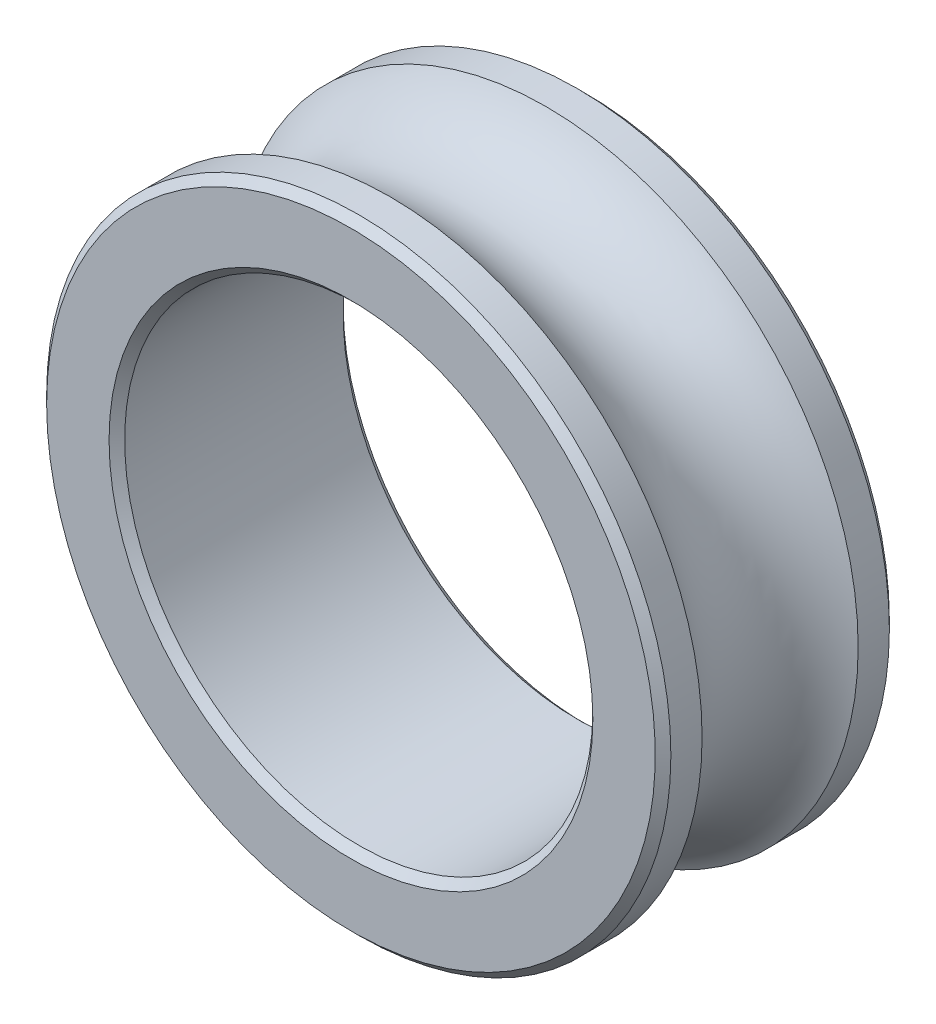
from build123d import *

# Parameters (mm, degrees)
CHAMFER1_SIZE = 25.4


with BuildPart() as part:
    # Sketch1 → Revolve1 (revolve)
    with BuildSketch(Plane(origin=(0, 0, 0), x_dir=(0, 0, -1), z_dir=(1, 0, 0)), mode=Mode.PRIVATE) as revolve1_sk:
        with BuildLine():
            Line((-381, 762), (381, 762))
            Line((381, 762), (381, 1016))
            Line((381, 1016), (254, 1016))
            ThreePointArc((254, 1016), (0, 866.453801319), (-254, 1016))
            Line((-254, 1016), (-381, 1016))
            Line((-381, 1016), (-381, 762))
        make_face()
    revolve(revolve1_sk.sketch.rotate(Axis((0, 0, 0), (0, 0, -1)), 90), axis=Axis((0, 0, 0), (0, 0, -1)))

    # Chamfer1
    chamfer1_edges = [part.edges().sort_by_distance(p)[0] for p in [
        (-1016, 0, -381),
        (-762, 0, -381),
        (-762, 0, 381),
        (-1016, 0, 381),
    ]]
    chamfer(chamfer1_edges, length=CHAMFER1_SIZE)


solid = part.part
